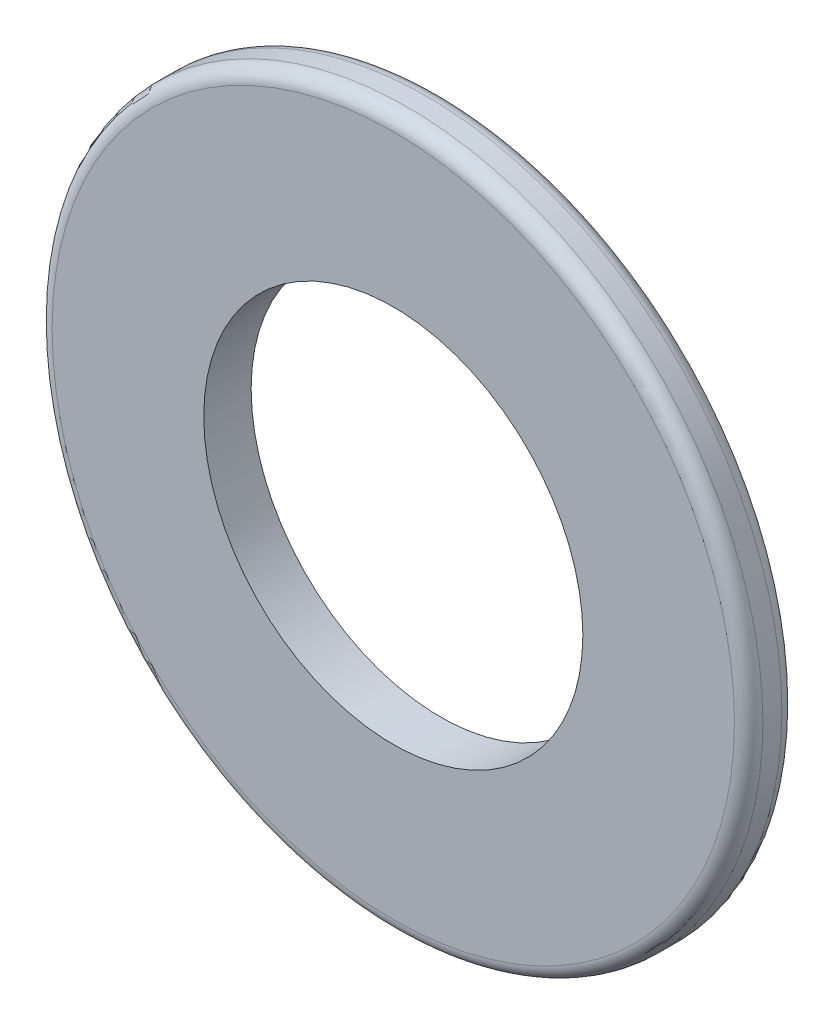
from build123d import *

# Parameters (mm, degrees)
SKETCH2_R           = 7.5
SKETCH2_R_2         = 4
BOSS_EXTRUDE1_DEPTH = 1
FILLET1_R           = 0.3
FILLET2_R           = 0.3


with BuildPart() as part:
    # Sketch2 → Boss-Extrude1 (new body)
    with BuildSketch(Plane.XY):
        Circle(SKETCH2_R)
        Circle(SKETCH2_R_2, mode=Mode.SUBTRACT)
    extrude(amount=BOSS_EXTRUDE1_DEPTH)

    # Fillet1
    fillet1_edges = [part.edges().sort_by_distance(p)[0] for p in [
        (-7.5, 0, 0),
    ]]
    fillet(fillet1_edges, radius=FILLET1_R)

    # Fillet2
    fillet2_edges = [part.edges().sort_by_distance(p)[0] for p in [
        (-7.5, 0, 1),
    ]]
    fillet(fillet2_edges, radius=FILLET2_R)


solid = part.part
